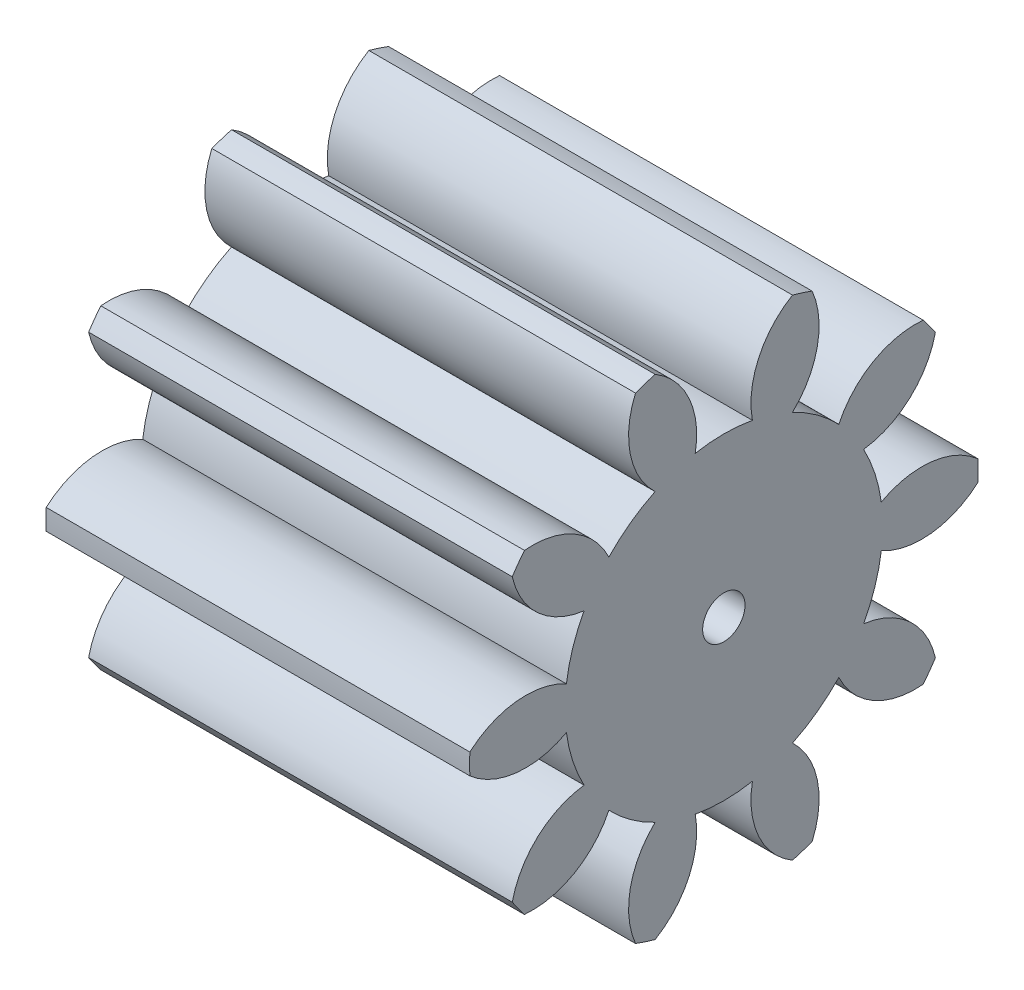
from build123d import *

# Parameters (mm, degrees)
BASPROSKE_W     = 20
BASPROSKE_H     = 12
TOOTHCUT_DEPTH  = 27.229754097
TEETHCUTS_COUNT = 10
TEETHCUTS_ANGLE = 324
BORSKE_R        = 1
BORE_DEPTH      = 50.0001016


with BuildPart() as part:
    # BasProSke → Base-Revolve (revolve)
    with BuildSketch(Plane(origin=(0, 0, 0), x_dir=(1, 0, 0), z_dir=(0, 1, 0)), mode=Mode.PRIVATE) as base_revolve_sk:
        with Locations((10, 6)):
            Rectangle(BASPROSKE_W, BASPROSKE_H)
    revolve(base_revolve_sk.sketch.rotate(Axis((-10, 0, 0), (1, 0, 0)), 180), axis=Axis((-10, 0, 0), (1, 0, 0)))

    # TooCutSke → ToothCut (cut, through all)
    with BuildSketch(Plane(origin=(0, 0, 0), x_dir=(0, 0, -1), z_dir=(1, 0, 0))):
        with BuildLine():
            ThreePointArc((1.349961767, 7.376489967), (0, 7.499), (-1.349961767, 7.376489967))
            ThreePointArc((-1.349961767, 7.376489967), (-1.644412889, 9.779161882), (-3.270793922, 11.572041837))
            ThreePointArc((-3.270793922, 11.572041837), (0, 12.0254), (3.270793922, 11.572041837))
            ThreePointArc((3.270793922, 11.572041837), (1.644412889, 9.779161882), (1.349961767, 7.376489967))
        make_face()
    toothcut = extrude(amount=TOOTHCUT_DEPTH, mode=Mode.SUBTRACT)

    # TeethCuts: ToothCut ×10 about axis
    teethcuts_axis = Axis((-10, 0, 0), (1, 0, 0))
    for i in range(1, TEETHCUTS_COUNT):
        add(toothcut.rotate(teethcuts_axis, i * TEETHCUTS_ANGLE / (TEETHCUTS_COUNT - 1)), mode=Mode.SUBTRACT)

    # BorSke → Bore (cut, symmetric)
    with BuildSketch(Plane(origin=(0, 0, 0), x_dir=(0, 0, -1), z_dir=(1, 0, 0))):
        with Locations(Location((0, 0, 0), (0, 0, 180))):
            Circle(BORSKE_R)
    extrude(amount=BORE_DEPTH, both=True, mode=Mode.SUBTRACT)


solid = part.part
